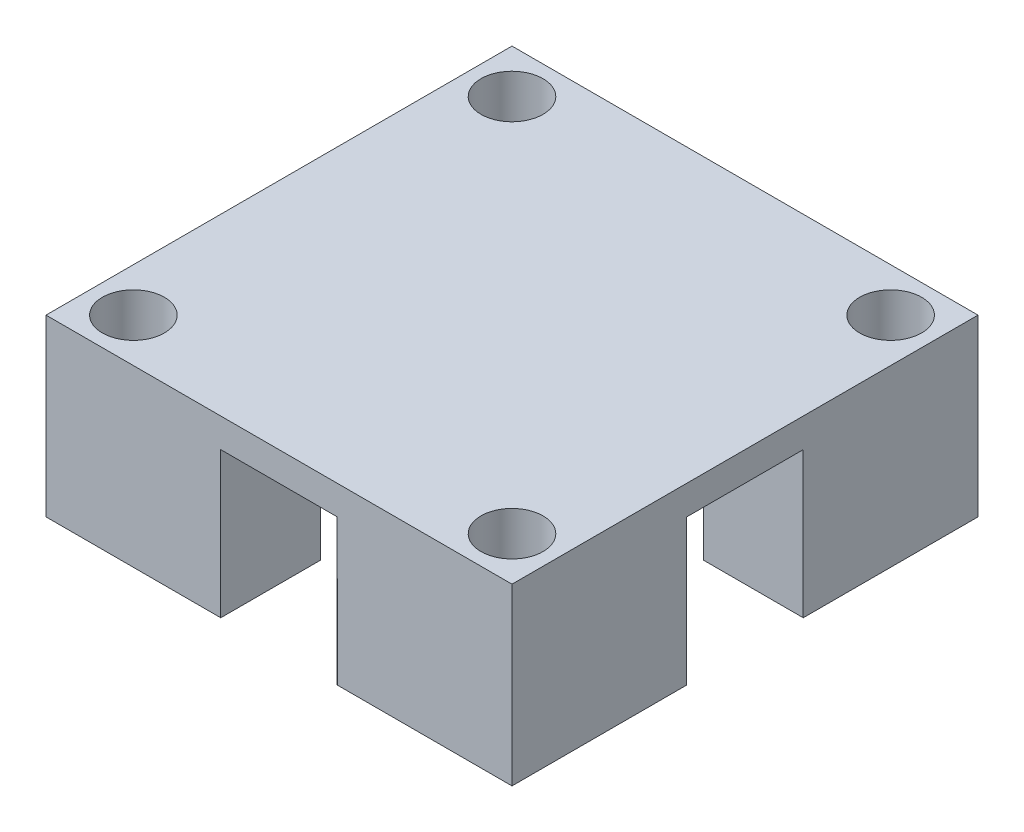
from build123d import *

# Parameters (mm, degrees)
SKETCH1_W               = 50.8
SKETCH1_H               = 50.8
BOSS_EXTRUDE1_DEPTH     = 19.05
F_1_4_CLEARANCE_HOLE1_D = 6.7564
SKETCH9_W               = 12.7
SKETCH9_H               = 12.7
CUT_EXTRUDE1_DEPTH      = 15.875


with BuildPart() as part:
    # Sketch1 → Boss-Extrude1 (new body)
    with BuildSketch(Plane(origin=(0, 0, 0), x_dir=(1, 0, 0), z_dir=(0, 1, 0))):
        Rectangle(SKETCH1_W, SKETCH1_H)
    extrude(amount=BOSS_EXTRUDE1_DEPTH)

    # 1/4 Clearance Hole1 (through all)
    with Locations(Plane(origin=(0, 19.05, 0), x_dir=(1, 0, 0), z_dir=(0, 1, 0))):
        with Locations((-20.6375, 20.6375), (20.6375, 20.6375), (20.6375, -20.6375), (-20.6375, -20.6375)):
            Hole(F_1_4_CLEARANCE_HOLE1_D / 2)

    # Sketch9 → Cut-Extrude1 (cut)
    with BuildSketch(Plane.XZ):
        with BuildLine():
            ThreePointArc((-6.35, 14.549677831), (-11.225320151, 11.225320151), (-14.549677831, 6.35))
            Line((-14.549677831, 6.35), (-6.35, 6.35))
            Line((-6.35, 6.35), (-6.35, 14.549677831))
        make_face()
        with BuildLine():
            Line((-6.35, 25.4), (-6.35, 14.549677831))
            ThreePointArc((-6.35, 14.549677831), (0, 15.875), (6.35, 14.549677831))
            Line((6.35, 14.549677831), (6.35, 25.4))
            Line((6.35, 25.4), (-6.35, 25.4))
        make_face()
        with BuildLine():
            Line((6.35, 14.549677831), (6.35, 6.35))
            Line((6.35, 6.35), (14.549677831, 6.35))
            ThreePointArc((14.549677831, 6.35), (11.225320151, 11.225320151), (6.35, 14.549677831))
        make_face()
        with BuildLine():
            Line((25.4, 6.35), (14.549677831, 6.35))
            ThreePointArc((14.549677831, 6.35), (15.540137718, 3.243415594), (15.875, 0))
            ThreePointArc((15.875, 0), (15.540137718, -3.243415594), (14.549677831, -6.35))
            Line((14.549677831, -6.35), (25.4, -6.35))
            Line((25.4, -6.35), (25.4, 6.35))
        make_face()
        with BuildLine():
            Line((14.549677831, -6.35), (6.35, -6.35))
            Line((6.35, -6.35), (6.35, -14.549677831))
            ThreePointArc((6.35, -14.549677831), (11.225320151, -11.225320151), (14.549677831, -6.35))
        make_face()
        with BuildLine():
            ThreePointArc((6.35, -14.549677831), (0, -15.875), (-6.35, -14.549677831))
            Line((-6.35, -14.549677831), (-6.35, -25.4))
            Line((-6.35, -25.4), (6.35, -25.4))
            Line((6.35, -25.4), (6.35, -14.549677831))
        make_face()
        with BuildLine():
            Line((-6.35, -6.35), (-14.549677831, -6.35))
            ThreePointArc((-14.549677831, -6.35), (-11.225320151, -11.225320151), (-6.35, -14.549677831))
            Line((-6.35, -14.549677831), (-6.35, -6.35))
        make_face()
        with BuildLine():
            Line((-14.549677831, 6.35), (-25.4, 6.35))
            Line((-25.4, 6.35), (-25.4, -6.35))
            Line((-25.4, -6.35), (-14.549677831, -6.35))
            ThreePointArc((-14.549677831, -6.35), (-15.875, 0), (-14.549677831, 6.35))
        make_face()
        with BuildLine():
            Line((-6.35, 6.35), (-14.549677831, 6.35))
            ThreePointArc((-14.549677831, 6.35), (-15.875, 0), (-14.549677831, -6.35))
            Line((-14.549677831, -6.35), (-6.35, -6.35))
            Line((-6.35, -6.35), (-6.35, 6.35))
        make_face()
        with BuildLine():
            Line((6.35, -6.35), (-6.35, -6.35))
            Line((-6.35, -6.35), (-6.35, -14.549677831))
            ThreePointArc((-6.35, -14.549677831), (0, -15.875), (6.35, -14.549677831))
            Line((6.35, -14.549677831), (6.35, -6.35))
        make_face()
        with BuildLine():
            Line((14.549677831, 6.35), (6.35, 6.35))
            Line((6.35, 6.35), (6.35, -6.35))
            Line((6.35, -6.35), (14.549677831, -6.35))
            ThreePointArc((14.549677831, -6.35), (15.540137718, -3.243415594), (15.875, 0))
            ThreePointArc((15.875, 0), (15.540137718, 3.243415594), (14.549677831, 6.35))
        make_face()
        Rectangle(SKETCH9_W, SKETCH9_H)
        with BuildLine():
            Line((-6.35, 14.549677831), (-6.35, 6.35))
            Line((-6.35, 6.35), (6.35, 6.35))
            Line((6.35, 6.35), (6.35, 14.549677831))
            ThreePointArc((6.35, 14.549677831), (0, 15.875), (-6.35, 14.549677831))
        make_face()
    extrude(amount=-CUT_EXTRUDE1_DEPTH, mode=Mode.SUBTRACT)


solid = part.part
